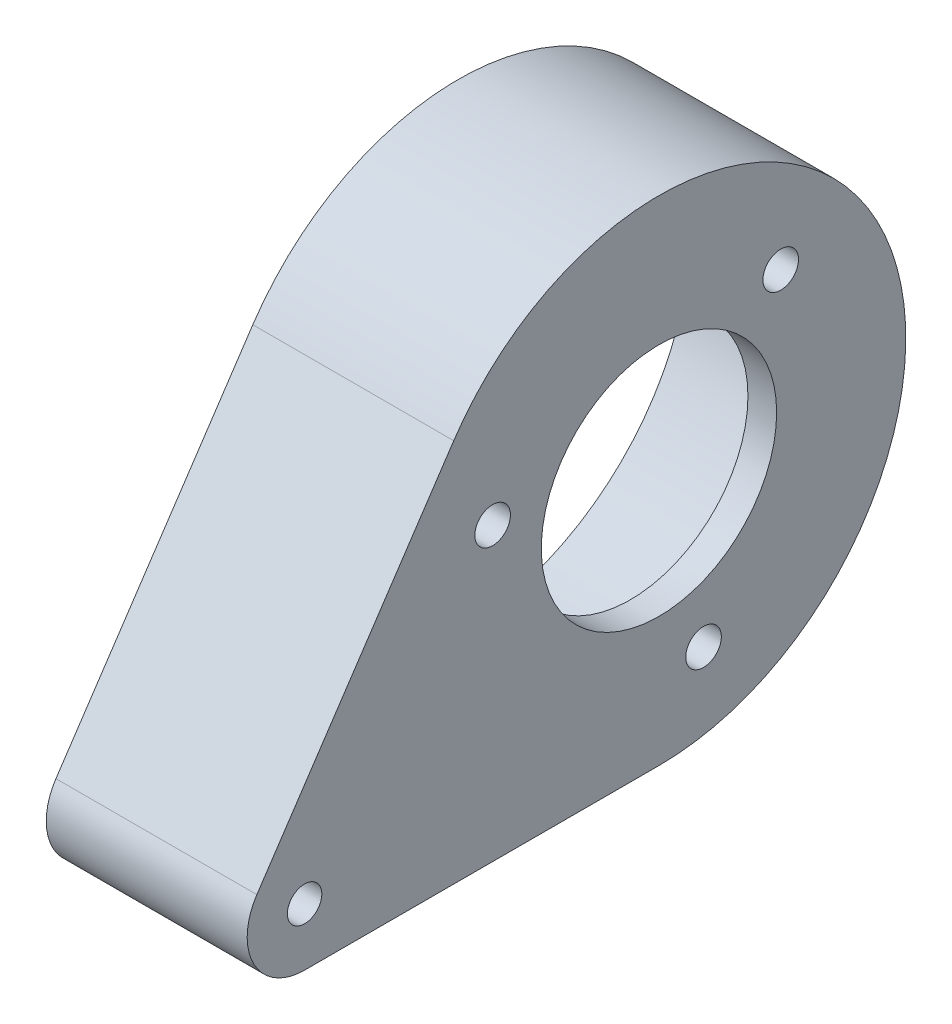
from build123d import *
from build123d.topology import SkipClean

# Parameters (mm, degrees)
EXTRUDE_1_DEPTH     = 2.5
EXTRUDE_START       = 15
SKETCH_2_R          = 20.25
EXTRUDE_2_DEPTH     = 15
SKETCH_3_R          = 1.55
SKETCH_3_R_2        = 10.25
CUT_EXTRUDE_1_DEPTH = 2.5
SKETCH_5_R          = 1.5
CUT_EXTRUDE_2_DEPTH = 46.33118669
CUT_EXTRUDE_3_DEPTH = 11


with BuildPart() as part:
    # Эскиз1 → Бобышка-Вытянуть1 (new body)
    with BuildSketch(Plane(origin=(0, 0, 0), x_dir=(0, 0, -1), z_dir=(1, 0, 0))):
        with BuildLine():
            Line((-30.866648668, -21.5), (0, -21.5))
            ThreePointArc((0, -21.5), (18.960941325, 10.135714286), (-17.877458963, 11.943469388))
            Line((-17.877458963, 11.943469388), (-35.024197264, -13.72244898))
            ThreePointArc((-35.024197264, -13.72244898), (-35.276169906, -18.857142857), (-30.866648668, -21.5))
        make_face()
    extrude(amount=EXTRUDE_1_DEPTH)

    # Эскиз2 → Бобышка-Вытянуть2 (add)
    with SkipClean():  # the faces are left unmerged after this step: merging them gives an invalid solid
        with BuildSketch(Plane.ZY.offset(EXTRUDE_START)):
            with BuildLine():
                Line((0, -21.5), (30.866648668, -21.5))
                ThreePointArc((30.866648668, -21.5), (35.276169906, -18.857142857), (35.024197264, -13.72244898))
                Line((35.024197264, -13.72244898), (17.877458963, 11.943469388))
                ThreePointArc((17.877458963, 11.943469388), (-18.960941325, 10.135714286), (0, -21.5))
            make_face()
            Circle(SKETCH_2_R, mode=Mode.SUBTRACT)
        extrude(amount=-EXTRUDE_2_DEPTH)

    # Эскиз3 → Вырез-Вытянуть1 (cut)
    with SkipClean():  # the faces are left unmerged after this step: merging them gives an invalid solid
        with BuildSketch(Plane(origin=(2.5, 0, 0), x_dir=(0, 0, -1), z_dir=(1, 0, 0))):
            with Locations((10.606601718, 10.606601718)):
                Circle(SKETCH_3_R)
            with Locations((3.882285677, -14.488887394)):
                Circle(SKETCH_3_R)
            with Locations((-14.488887394, 3.882285677)):
                Circle(SKETCH_3_R)
            Circle(SKETCH_3_R_2)
        extrude(amount=-CUT_EXTRUDE_1_DEPTH, mode=Mode.SUBTRACT)

    # Эскиз5 → Вырез-Вытянуть2 (cut, through all)
    with SkipClean():  # the faces are left unmerged after this step: merging them gives an invalid solid
        with BuildSketch(Plane.ZY.offset(15)):
            with Locations((30.866648668, -16.5)):
                Circle(SKETCH_5_R)
        extrude(amount=-CUT_EXTRUDE_2_DEPTH, mode=Mode.SUBTRACT)

    # Эскиз6 → Вырез-Вытянуть3 (cut)
    with SkipClean():  # the faces are left unmerged after this step: merging them gives an invalid solid
        with BuildSketch(Plane.ZY.offset(15)):
            Polygon((21.25, 4.5), (20.25, 4.5), (19.743669872, 4.5), (19.743669872, -4.5), (20.25, -4.5), (21.25, -4.5), align=None)
        extrude(amount=-CUT_EXTRUDE_3_DEPTH, mode=Mode.SUBTRACT)


solid = part.part
